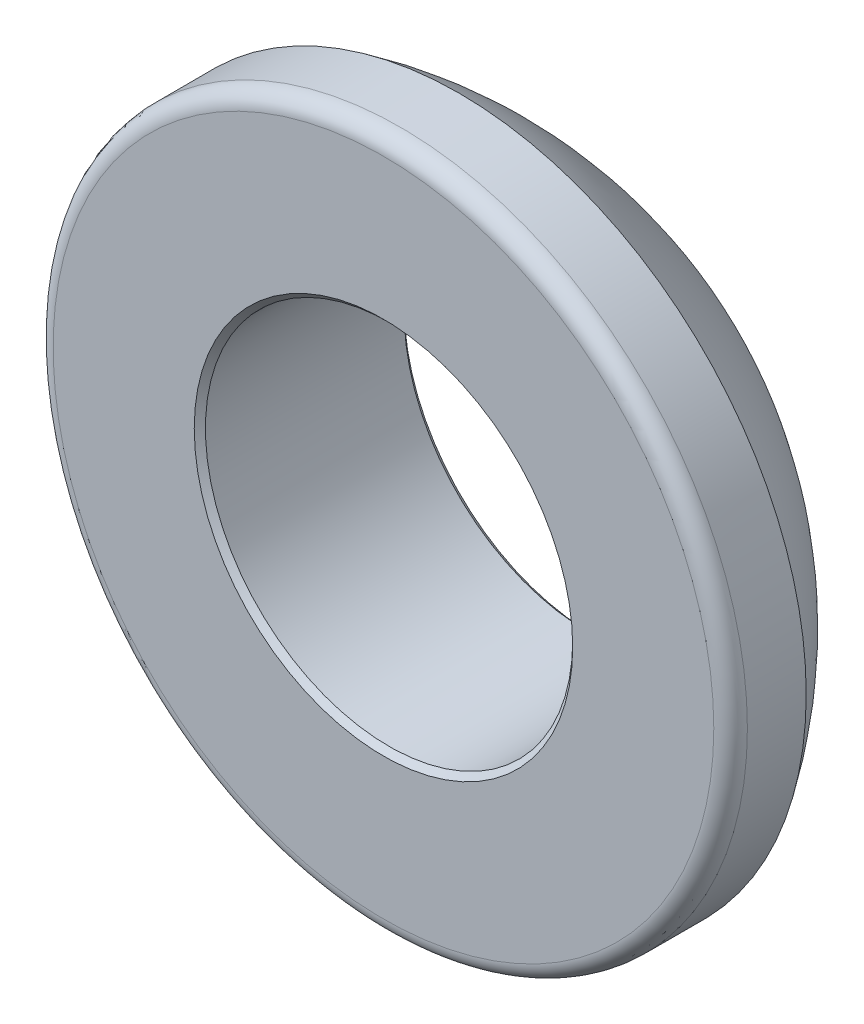
from build123d import *


with BuildPart() as part:
    # Sketch1 → Revolve1 (revolve)
    with BuildSketch(Plane(origin=(0, 0, 0), x_dir=(0, 0, -1), z_dir=(1, 0, 0))):
        with BuildLine():
            Line((9.271, 8.3312), (9.525, 8.5852))
            Line((9.525, 8.5852), (9.525, 9.109220524))
            ThreePointArc((9.525, 9.109220524), (6.878832982, 12.796695255), (3.430721893, 15.748))
            Line((3.430721893, 15.748), (0.762, 15.748))
            ThreePointArc((0.762, 15.748), (0.223184633, 15.524815367), (0, 14.986))
            Line((0, 14.986), (0, 8.5852))
            Line((0, 8.5852), (0.254, 8.3312))
            Line((0.254, 8.3312), (9.271, 8.3312))
        make_face()
    revolve(axis=Axis((0, 0, -32.643147388), (0, 0, -1)))


solid = part.part
